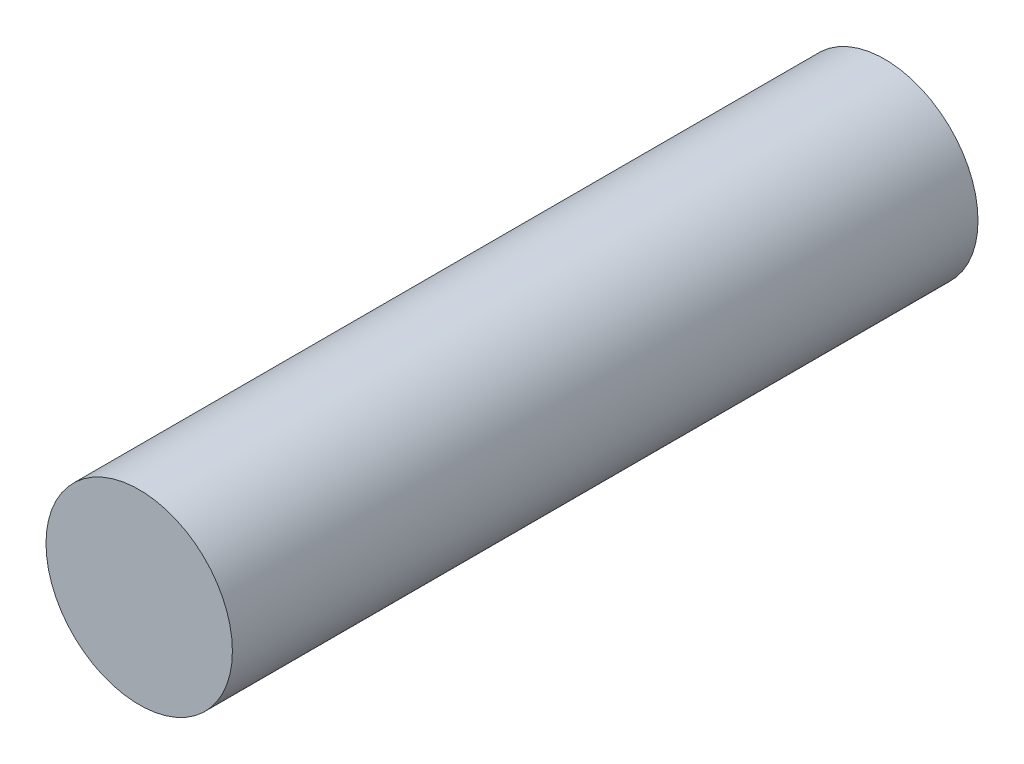
from build123d import *

# Parameters (mm, degrees)
SKETCH_1_R      = 1.375
EXTRUDE_1_DEPTH = 11


with BuildPart() as part:
    # 草图1 → 凸台-拉伸1 (new body)
    with BuildSketch(Plane.XY):
        with Locations((-9.462033654, 6.021294143)):
            Circle(SKETCH_1_R)
    extrude(amount=EXTRUDE_1_DEPTH)


solid = part.part
